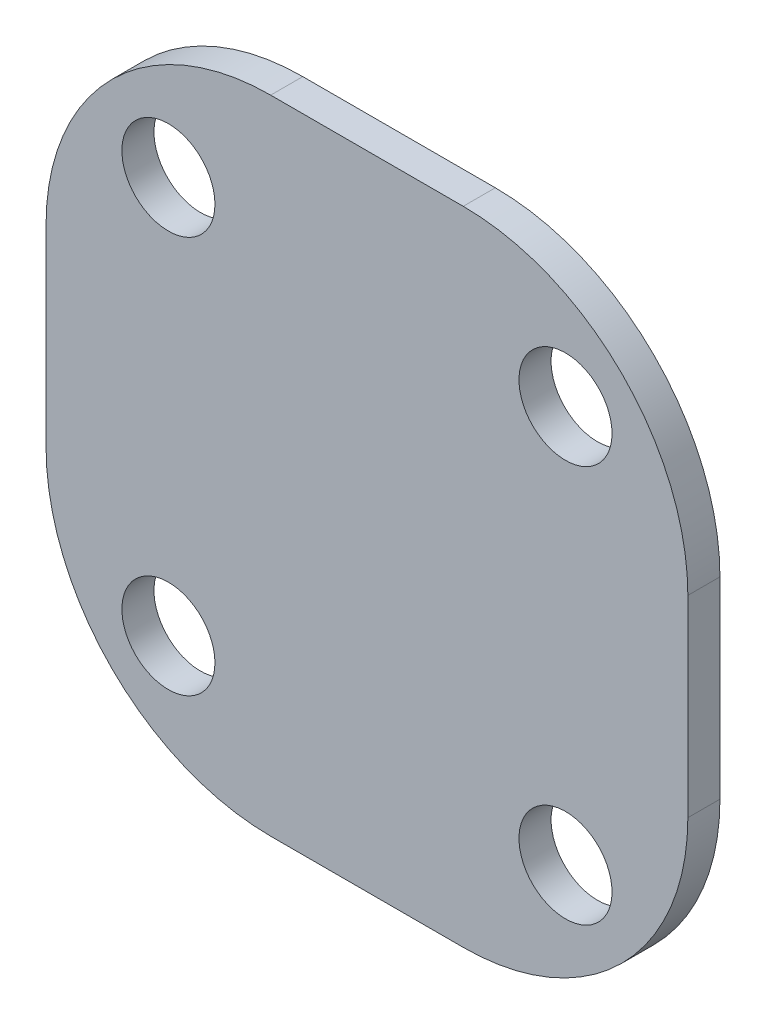
from build123d import *

# Parameters (mm, degrees)
SKETCH1_W                      = 25.4
SKETCH1_H                      = 25.4
BOSS_EXTRUDE1_DEPTH            = 1.27
MOUNTING_HOLES_FOR_MOTOR_REACH = 37.943
SKETCH8_R                      = 1.8415
FILLET2_R                      = 8.89


with BuildPart() as part:
    # Sketch1 → Boss-Extrude1 (new body)
    with BuildSketch(Plane.XY):
        with Locations((12.7, -12.7)):
            Rectangle(SKETCH1_W, SKETCH1_H)
    extrude(amount=BOSS_EXTRUDE1_DEPTH)

    # Sketch8 → Mounting Holes for Motor (cut, up to next)
    with BuildSketch(Plane.XY.offset(1.27), mode=Mode.PRIVATE) as mounting_holes_for_motor_sk1:
        with Locations((20.557724106, -4.842275894)):
            Circle(SKETCH8_R)
    mounting_holes_for_motor_tool1 = extrude(mounting_holes_for_motor_sk1.sketch, amount=-MOUNTING_HOLES_FOR_MOTOR_REACH, mode=Mode.PRIVATE) & part.part
    # Sketch8 → Mounting Holes for Motor (cut, up to next)
    with BuildSketch(Plane.XY.offset(1.27), mode=Mode.PRIVATE) as mounting_holes_for_motor_sk2:
        with Locations((4.842275894, -4.842275894)):
            Circle(SKETCH8_R)
    mounting_holes_for_motor_tool2 = extrude(mounting_holes_for_motor_sk2.sketch, amount=-MOUNTING_HOLES_FOR_MOTOR_REACH, mode=Mode.PRIVATE) & part.part
    # Sketch8 → Mounting Holes for Motor (cut, up to next)
    with BuildSketch(Plane.XY.offset(1.27), mode=Mode.PRIVATE) as mounting_holes_for_motor_sk3:
        with Locations((4.842275894, -20.557724106)):
            Circle(SKETCH8_R)
    mounting_holes_for_motor_tool3 = extrude(mounting_holes_for_motor_sk3.sketch, amount=-MOUNTING_HOLES_FOR_MOTOR_REACH, mode=Mode.PRIVATE) & part.part
    # Sketch8 → Mounting Holes for Motor (cut, up to next)
    with BuildSketch(Plane.XY.offset(1.27), mode=Mode.PRIVATE) as mounting_holes_for_motor_sk4:
        with Locations((20.557724106, -20.557724106)):
            Circle(SKETCH8_R)
    mounting_holes_for_motor_tool4 = extrude(mounting_holes_for_motor_sk4.sketch, amount=-MOUNTING_HOLES_FOR_MOTOR_REACH, mode=Mode.PRIVATE) & part.part
    add(mounting_holes_for_motor_tool1.solids().sort_by_distance((20.557724, -4.842276, 1.27))[0], mode=Mode.SUBTRACT)
    add(mounting_holes_for_motor_tool2.solids().sort_by_distance((4.842276, -4.842276, 1.27))[0], mode=Mode.SUBTRACT)
    add(mounting_holes_for_motor_tool3.solids().sort_by_distance((4.842276, -20.557724, 1.27))[0], mode=Mode.SUBTRACT)
    add(mounting_holes_for_motor_tool4.solids().sort_by_distance((20.557724, -20.557724, 1.27))[0], mode=Mode.SUBTRACT)

    # Fillet2
    fillet2_edges = [part.edges().sort_by_distance(p)[0] for p in [
        (0, 0, 0.635),
        (25.4, 0, 0.635),
        (25.4, -25.4, 0.635),
        (0, -25.4, 0.635),
    ]]
    fillet(fillet2_edges, radius=FILLET2_R)


solid = part.part
